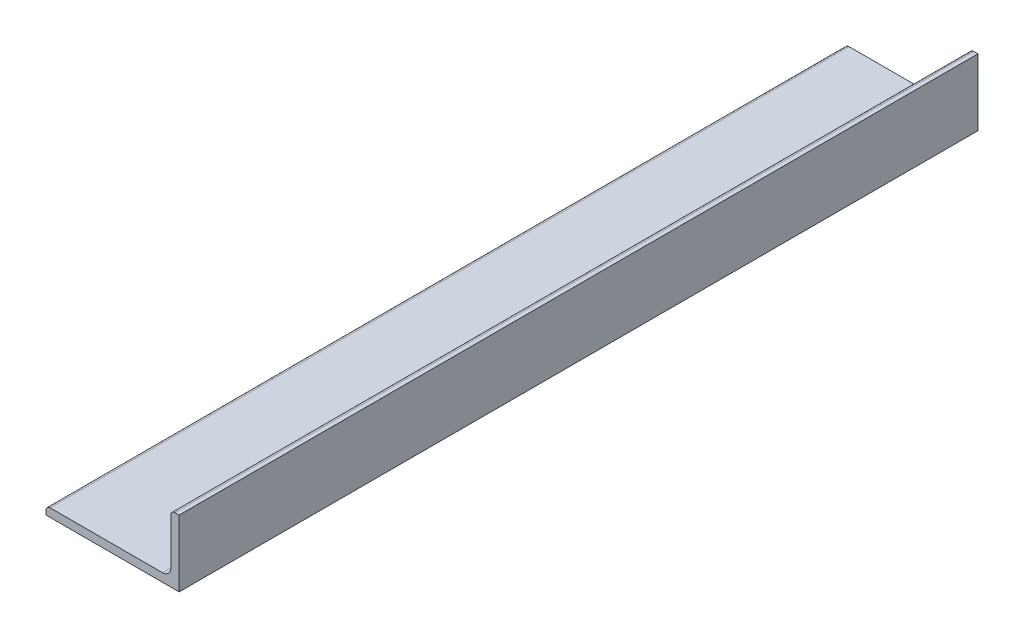
from build123d import *

# Parameters (mm, degrees)
BOSS_EXTRUDE1_DEPTH = 152.4


with BuildPart() as part:
    # Sketch2 → Boss-Extrude1 (new, symmetric)
    with BuildSketch(Plane.XY):
        with BuildLine():
            Line((-25.4, -12.7), (25.4, -12.7))
            Line((25.4, -12.7), (25.4, 12.7))
            Line((25.4, 12.7), (23.8125, 12.7))
            ThreePointArc((23.8125, 12.7), (22.689967985, 12.235032015), (22.225, 11.1125))
            Line((22.225, 11.1125), (22.225, -6.35))
            ThreePointArc((22.225, -6.35), (21.29506403, -8.59506403), (19.05, -9.525))
            Line((19.05, -9.525), (-23.8125, -9.525))
            ThreePointArc((-23.8125, -9.525), (-24.935032015, -9.989967985), (-25.4, -11.1125))
            Line((-25.4, -11.1125), (-25.4, -12.7))
        make_face()
    extrude(amount=BOSS_EXTRUDE1_DEPTH, both=True)


solid = part.part
